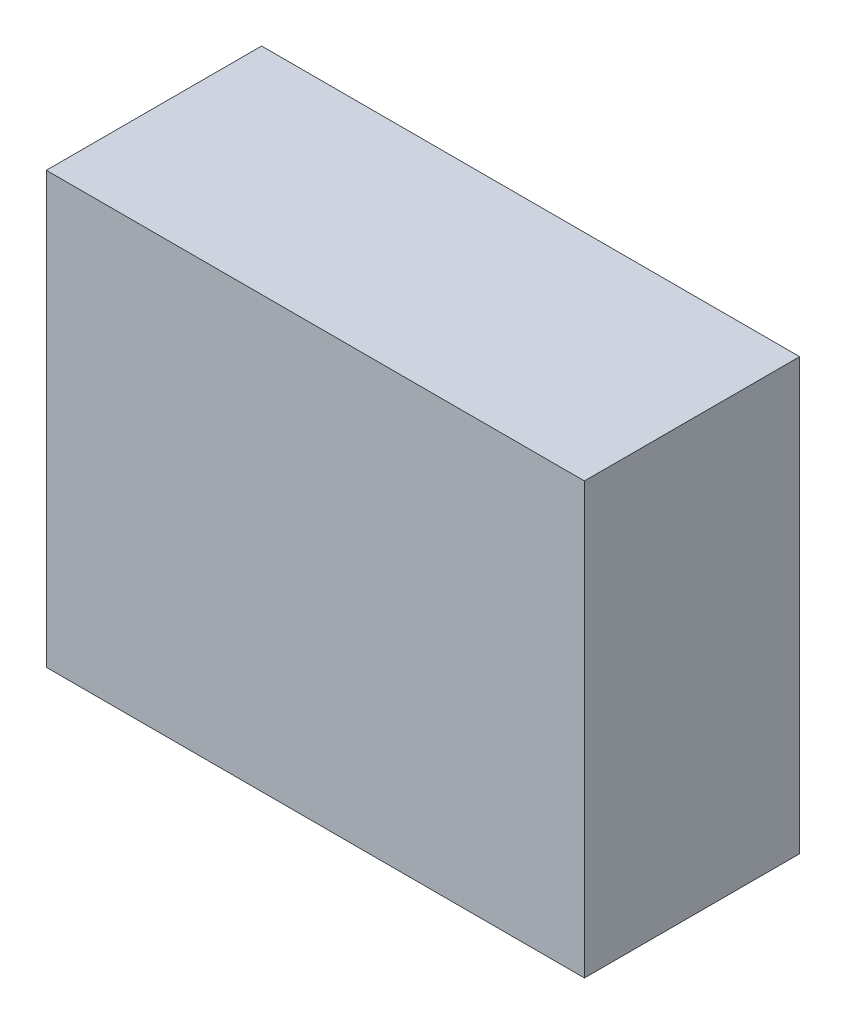
from build123d import *

# Parameters (mm, degrees)
SKETCH1_W           = 25
SKETCH1_H           = 20
BOSS_EXTRUDE1_DEPTH = 10


with BuildPart() as part:
    # Sketch1 → Boss-Extrude1 (new body)
    with BuildSketch(Plane.XY):
        with Locations((12.5, 10)):
            Rectangle(SKETCH1_W, SKETCH1_H)
    extrude(amount=BOSS_EXTRUDE1_DEPTH)


solid = part.part
